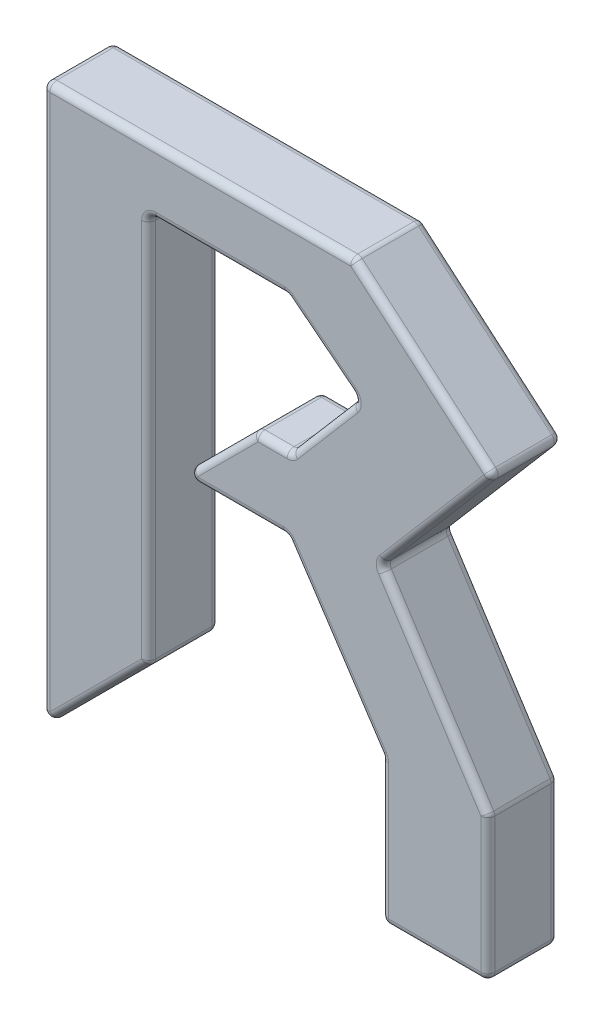
from build123d import *

# Parameters (mm, degrees)
BOSS_EXTRUDE1_DEPTH = 10
FILLET3_R           = 1


with BuildPart() as part:
    # Sketch3 → Boss-Extrude1 (new body)
    with BuildSketch(Plane.XY):
        Polygon((0, 69.747073231), (0, 0), (0, -10), (15.06772633, 5.06772633), (15.06772633, 15.577629005), (15.06772633, 60.522611967), (34.746102146, 60.522611967), (44.75412708, 52.626214838), (35.220089692, 41.487878952), (30.220089692, 41.487878952), (19.613487974, 30.881277234), (34.746102146, 30.881277234), (48.208411003, 10.536544123), (48.208411003, 0), (48.208411003, -10), (63.3304478, -10), (63.3304478, -0.075498865), (63.3304478, 0), (63.3304478, 10.536544123), (48.208411003, 33.963716022), (64.182876427, 52.626214838), (44.18108037, 69.747073231), align=None)
    extrude(amount=BOSS_EXTRUDE1_DEPTH)

    # Fillet3
    fillet3_edges = [part.edges().sort_by_distance(p)[0] for p in [
        (48.208411003, 0.268272062, 10),
        (55.769429402, -10, 10),
        (27.17979506, 30.881277234, 0),
        (24.916788833, 36.184578093, 0),
        (32.720089692, 41.487878952, 0),
        (39.987108386, 47.057046895, 0),
        (39.750114613, 56.574413402, 0),
        (24.906914238, 60.522611967, 0),
        (63.3304478, 0.268272062, 10),
        (15.06772633, 32.795169148, 0),
        (7.533863165, -2.466136835, 0),
        (0, 29.873536616, 0),
        (22.090540185, 69.747073231, 0),
        (54.181978398, 61.186644035, 0),
        (56.195643715, 43.29496543, 0),
        (55.769429402, 22.250130073, 0),
        (63.3304478, 0.268272062, 0),
        (55.769429402, -10, 0),
        (48.208411003, 0.268272062, 0),
        (41.477256575, 20.708910679, 0),
        (55.769429402, 22.250130073, 10),
        (34.746102146, 30.881277234, 5),
        (19.613487974, 30.881277234, 5),
        (30.220089692, 41.487878952, 5),
        (35.220089692, 41.487878952, 5),
        (44.75412708, 52.626214838, 5),
        (56.195643715, 43.29496543, 10),
        (34.746102146, 60.522611967, 5),
        (15.06772633, 60.522611967, 5),
        (15.06772633, 5.06772633, 5),
        (0, -10, 5),
        (0, 69.747073231, 5),
        (44.18108037, 69.747073231, 5),
        (64.182876427, 52.626214838, 5),
        (48.208411003, 33.963716022, 5),
        (63.3304478, 10.536544123, 5),
        (63.3304478, -10, 5),
        (48.208411003, -10, 5),
        (48.208411003, 10.536544123, 5),
        (54.181978398, 61.186644035, 10),
        (22.090540185, 69.747073231, 10),
        (0, 29.873536616, 10),
        (7.533863165, -2.466136835, 10),
        (41.477256575, 20.708910679, 10),
        (15.06772633, 32.795169148, 10),
        (24.906914238, 60.522611967, 10),
        (39.750114613, 56.574413402, 10),
        (39.987108386, 47.057046895, 10),
        (32.720089692, 41.487878952, 10),
        (24.916788833, 36.184578093, 10),
        (27.17979506, 30.881277234, 10),
    ]]
    fillet(fillet3_edges, radius=FILLET3_R)


solid = part.part
